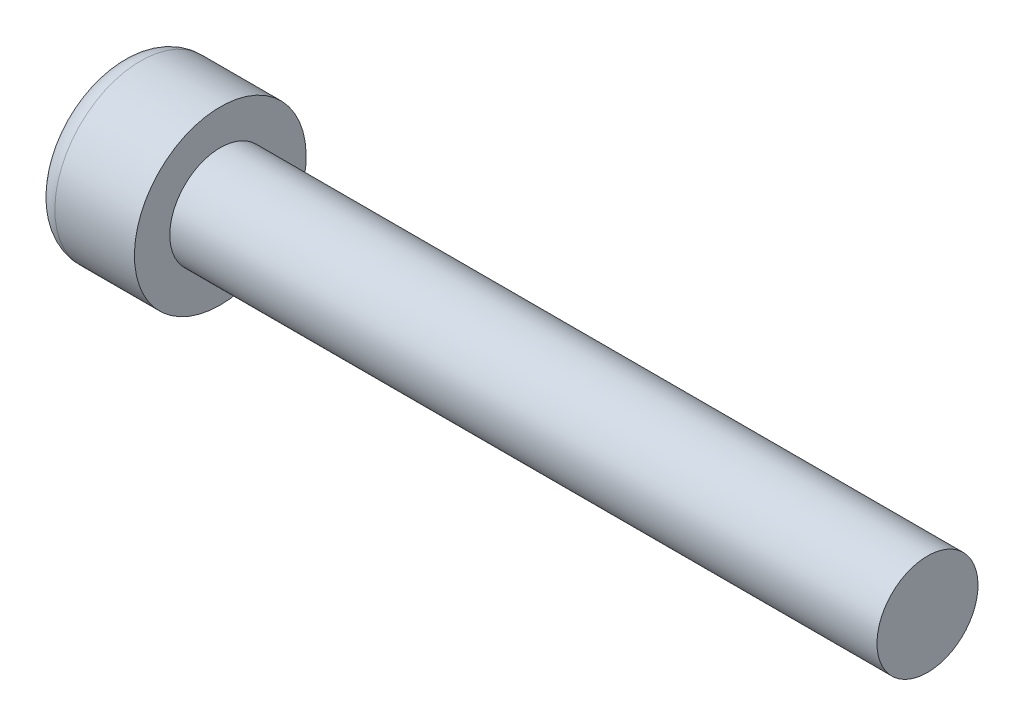
from build123d import *

# Parameters (mm, degrees)
CUT_EXTRUDE1_DEPTH = 2.5


with BuildPart() as part:
    # Sketch1 → Revolve1 (revolve)
    with BuildSketch(Plane.XY, mode=Mode.PRIVATE) as revolve1_sk:
        with BuildLine():
            Line((0, 0), (0, 3.1875))
            ThreePointArc((0, 3.1875), (0.311199045, 3.938800955), (1.0625, 4.25))
            Line((1.0625, 4.25), (5, 4.25))
            Line((5, 4.25), (5, 2.5))
            Line((5, 2.5), (40, 2.5))
            Line((40, 2.5), (40, 0))
            Line((40, 0), (0, 0))
        make_face()
    revolve(revolve1_sk.sketch.rotate(Axis((0, 0, 0), (1, 0, 0)), 180), axis=Axis((0, 0, 0), (1, 0, 0)))

    # Sketch2 → Cut-Extrude1 (cut)
    with BuildSketch(Plane.ZY):
        Polygon((0, 2.309401077), (-2, 1.154700538), (-2, -1.154700538), (0, -2.309401077), (2, -1.154700538), (2, 1.154700538), align=None)
    extrude(amount=-CUT_EXTRUDE1_DEPTH, mode=Mode.SUBTRACT)


solid = part.part
